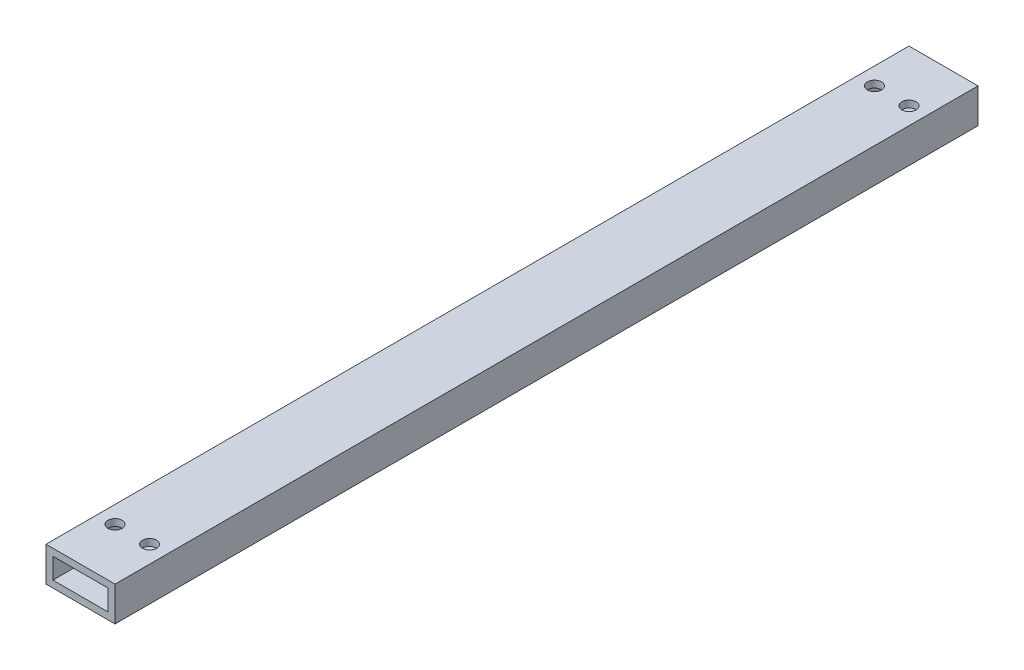
from build123d import *

# Parameters (mm, degrees)
SKETCH_1_W          = 20
SKETCH_1_H          = 10
SKETCH_1_W_2        = 16
SKETCH_1_H_2        = 6
EXTRUDE_1_DEPTH     = 125
SKETCH_3_R          = 2.05
CUT_EXTRUDE_1_DEPTH = 126.800383248


with BuildPart() as part:
    # 草图1 → 凸台-拉伸1 (new, symmetric)
    with BuildSketch(Plane.XY):
        with Locations((0.036753729, 0.03823935)):
            Rectangle(SKETCH_1_W, SKETCH_1_H)
        with Locations((0.036753729, 0.03823935)):
            Rectangle(SKETCH_1_W_2, SKETCH_1_H_2, mode=Mode.SUBTRACT)
    extrude(amount=EXTRUDE_1_DEPTH, both=True)

    # 草图3 → 切除-拉伸1 (cut, through all)
    with BuildSketch(Plane(origin=(0, 5.03823935, 0), x_dir=(1, 0, 0), z_dir=(0, 1, 0))):
        with Locations(Location((-4.963246271, 110, 0), (0, 0, 270))):
            Circle(SKETCH_3_R)
        with Locations(Location((5.036753729, 110, 0), (0, 0, 270))):
            Circle(SKETCH_3_R)
    cut_extrude_1 = extrude(amount=-CUT_EXTRUDE_1_DEPTH, mode=Mode.SUBTRACT)

    # 镜向1: 切除-拉伸1 across plane
    add(cut_extrude_1.mirror(Plane.XY), mode=Mode.SUBTRACT)


solid = part.part
